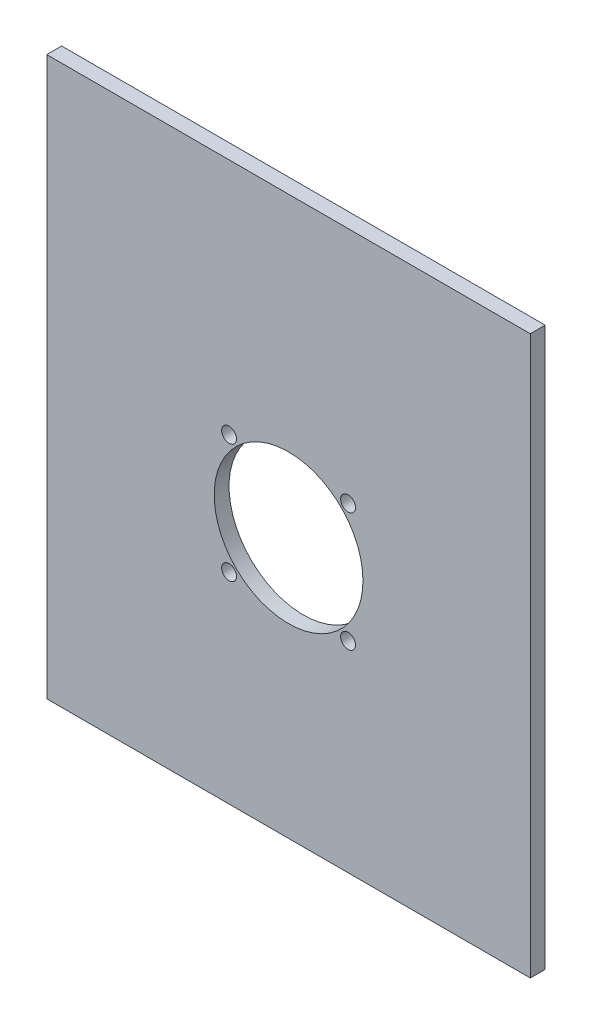
from build123d import *

# Parameters (mm, degrees)
SKETCH1_W           = 130
SKETCH1_H           = 150
BOSS_EXTRUDE1_DEPTH = 4
SKETCH9_R           = 20
CUT_EXTRUDE4_DEPTH  = 4
SKETCH3_R           = 2
CUT_EXTRUDE5_DEPTH  = 4


with BuildPart() as part:
    # Sketch1 → Boss-Extrude1 (new body)
    with BuildSketch(Plane.XY):
        with Locations((-47.824675325, -10.633116883)):
            Rectangle(SKETCH1_W, SKETCH1_H)
    extrude(amount=BOSS_EXTRUDE1_DEPTH)

    # Sketch9 → Cut-Extrude4 (cut)
    with BuildSketch(Plane.XY.offset(4)):
        with Locations((-47.824675325, -15.633116883)):
            Circle(SKETCH9_R)
    extrude(amount=-CUT_EXTRUDE4_DEPTH, mode=Mode.SUBTRACT)

    # Sketch3 → Cut-Extrude5 (cut)
    with BuildSketch(Plane.XY.offset(4)):
        with Locations((-63.824675325, 0.366883117)):
            Circle(SKETCH3_R)
        with Locations((-31.824675325, 0.366883117)):
            Circle(SKETCH3_R)
        with Locations((-31.824675325, -31.633116883)):
            Circle(SKETCH3_R)
        with Locations((-63.824675325, -31.633116883)):
            Circle(SKETCH3_R)
    extrude(amount=-CUT_EXTRUDE5_DEPTH, mode=Mode.SUBTRACT)


solid = part.part
